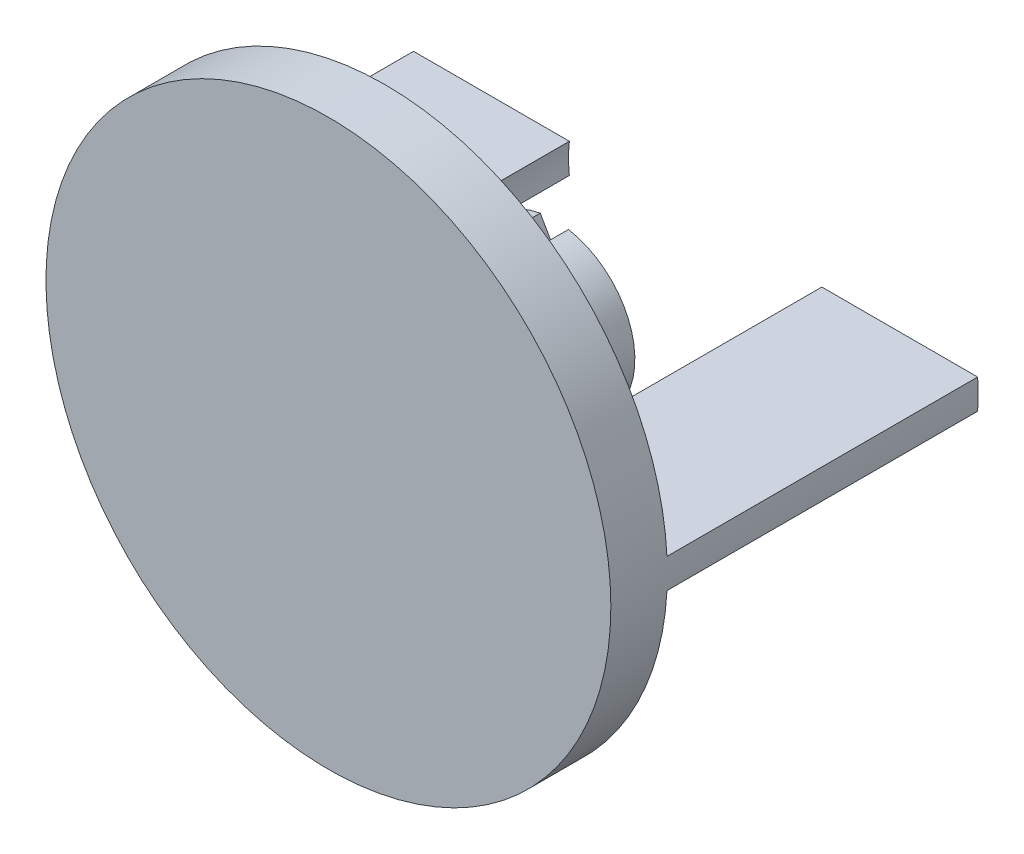
from build123d import *
from build123d.topology import SkipClean

# Parameters (mm, degrees)
SKETCH1_R           = 2.85
BOSS_EXTRUDE1_DEPTH = 1
SKETCH2_R           = 10
BOSS_EXTRUDE2_DEPTH = 2
BOSS_EXTRUDE3_START = 1
BOSS_EXTRUDE3_DEPTH = 1
CUT_EXTRUDE1_DEPTH  = 1
BOSS_EXTRUDE4_START = 5
BOSS_EXTRUDE4_DEPTH = 5
BOSS_EXTRUDE5_START = 10
BOSS_EXTRUDE5_DEPTH = 10


with BuildPart() as part:
    # Sketch1 → Boss-Extrude1 (new body)
    with BuildSketch(Plane.XY):
        Circle(SKETCH1_R)
    extrude(amount=BOSS_EXTRUDE1_DEPTH)

    # Sketch2 → Boss-Extrude2 (add)
    with BuildSketch(Plane.XY.offset(1)):
        Circle(SKETCH2_R)
    extrude(amount=BOSS_EXTRUDE2_DEPTH)

    # Sketch3 → Boss-Extrude3 (add)
    with BuildSketch(Plane(origin=(0, 0, 1), x_dir=(-1, 0, 0), z_dir=(0, 0, -1)).offset(BOSS_EXTRUDE3_START)):
        with BuildLine():
            Line((-9.986209241, 0.525), (9.986209241, 0.525))
            ThreePointArc((9.986209241, 0.525), (10, 0), (9.986209241, -0.525))
            Line((9.986209241, -0.525), (-9.986209241, -0.525))
            ThreePointArc((-9.986209241, -0.525), (-10, 0), (-9.986209241, 0.525))
        make_face()
    extrude(amount=-BOSS_EXTRUDE3_DEPTH)

    # Sketch4 → Cut-Extrude1 (cut)
    with BuildSketch(Plane(origin=(0, 0, 0), x_dir=(-1, 0, 0), z_dir=(0, 0, -1))):
        with BuildLine():
            ThreePointArc((0.5, 2.805797569), (0, 2.85), (-0.5, 2.805797569))
            Line((-0.5, 2.805797569), (0, 1.939772166))
            Line((0, 1.939772166), (0.5, 2.805797569))
        make_face()
    extrude(amount=-CUT_EXTRUDE1_DEPTH, mode=Mode.SUBTRACT)

    # Sketch5 → Boss-Extrude4 (add)
    with SkipClean():  # the faces are left unmerged after this step: merging them gives an invalid solid
        with BuildSketch(Plane(origin=(0, 0, 0), x_dir=(-1, 0, 0), z_dir=(0, 0, -1)).offset(BOSS_EXTRUDE4_START)):
            with BuildLine():
                ThreePointArc((2.80122741, 0.525), (2.006248985, 2.024219605), (0.5, 2.805797569))
                Line((0.5, 2.805797569), (0, 1.939772166))
                Line((0, 1.939772166), (-0.5, 2.805797569))
                ThreePointArc((-0.5, 2.805797569), (-2.006248985, 2.024219605), (-2.80122741, 0.525))
                ThreePointArc((-2.80122741, 0.525), (-2.85, 0), (-2.80122741, -0.525))
                ThreePointArc((-2.80122741, -0.525), (0, -2.85), (2.80122741, -0.525))
                ThreePointArc((2.80122741, -0.525), (2.85, 0), (2.80122741, 0.525))
            make_face()
        extrude(amount=-BOSS_EXTRUDE4_DEPTH)

    # Sketch6 → Boss-Extrude5 (add)
    with SkipClean():  # the faces are left unmerged after this step: merging them gives an invalid solid
        with BuildSketch(Plane(origin=(0, 0, 0), x_dir=(-1, 0, 0), z_dir=(0, 0, -1)).offset(BOSS_EXTRUDE5_START)):
            with BuildLine():
                ThreePointArc((-4.469270075, -0.525), (-4.5, 0), (-4.469270075, 0.525))
                Line((-4.469270075, 0.525), (-9.986209241, 0.525))
                ThreePointArc((-9.986209241, 0.525), (-10, 0), (-9.986209241, -0.525))
                Line((-9.986209241, -0.525), (-4.469270075, -0.525))
            make_face()
            with BuildLine():
                ThreePointArc((4.469270075, 0.525), (4.5, 0), (4.469270075, -0.525))
                Line((4.469270075, -0.525), (9.986209241, -0.525))
                ThreePointArc((9.986209241, -0.525), (10, 0), (9.986209241, 0.525))
                Line((9.986209241, 0.525), (4.469270075, 0.525))
            make_face()
        extrude(amount=-BOSS_EXTRUDE5_DEPTH)


solid = part.part
